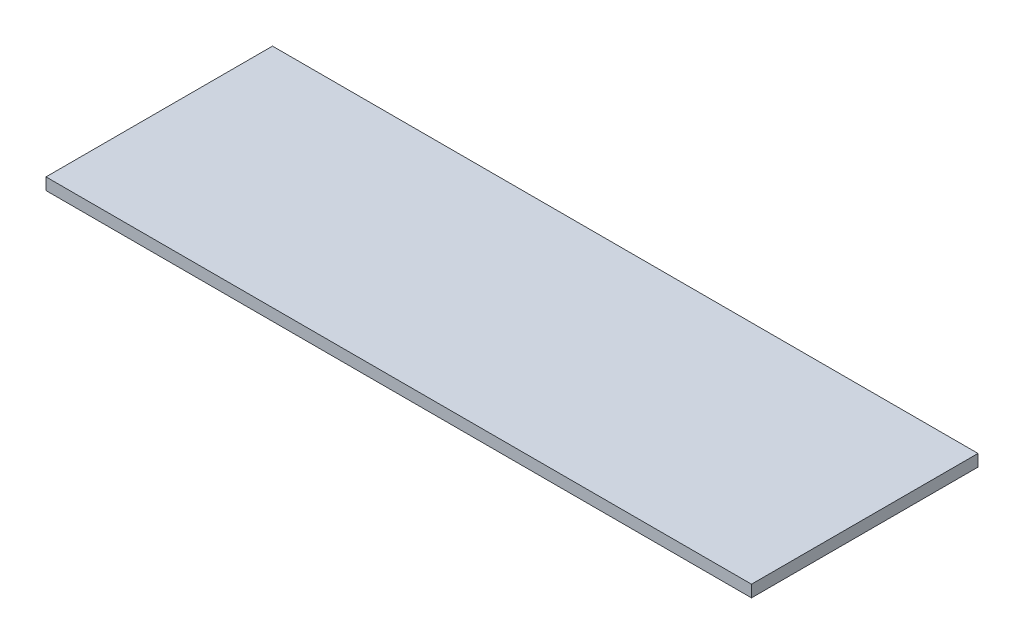
from build123d import *

# Parameters (mm, degrees)
SKETCH1_W           = 190
SKETCH1_H           = 61
BOSS_EXTRUDE1_DEPTH = 3.2


with BuildPart() as part:
    # Sketch1 → Boss-Extrude1 (new body)
    with BuildSketch(Plane(origin=(0, 0, 0), x_dir=(1, 0, 0), z_dir=(0, 1, 0))):
        Rectangle(SKETCH1_W, SKETCH1_H)
    extrude(amount=BOSS_EXTRUDE1_DEPTH)


solid = part.part
